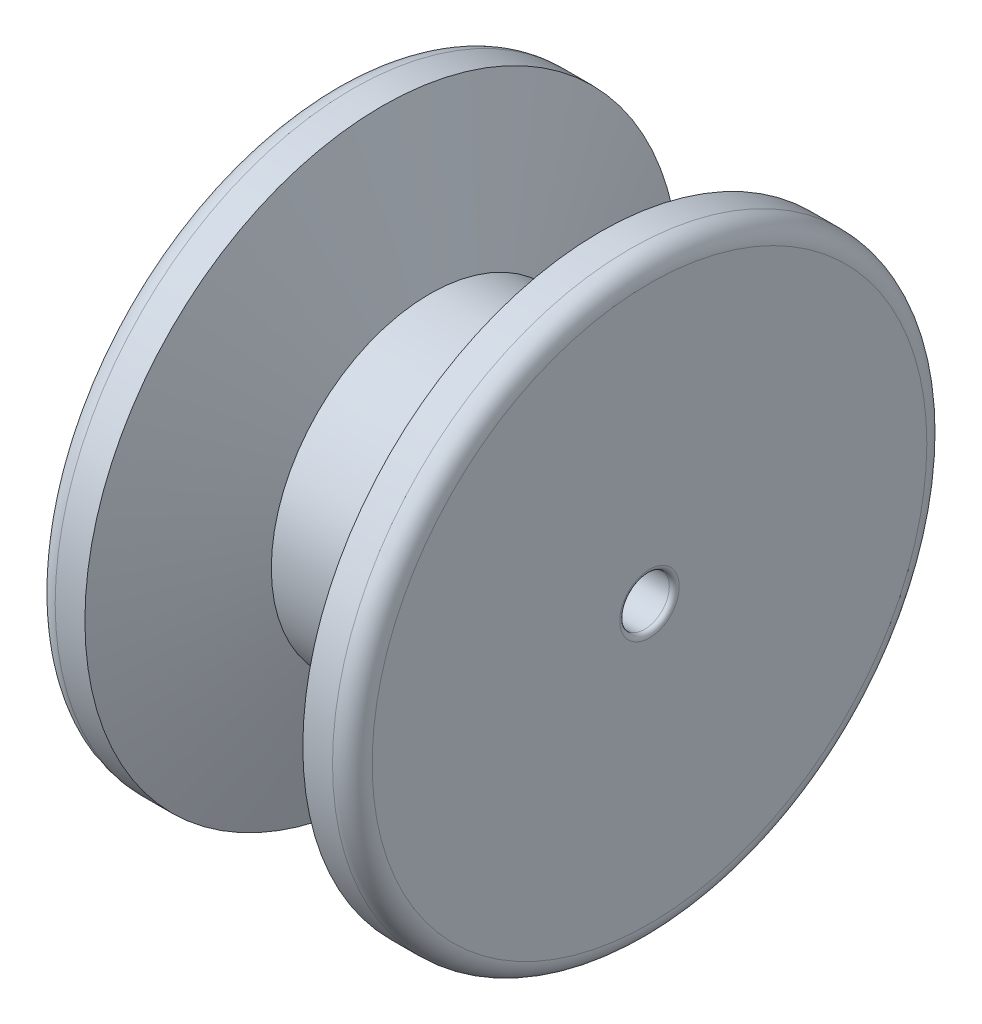
from build123d import *

# Parameters (mm, degrees)
REDONDEO2_R = 2
REDONDEO3_R = 0.5


with BuildPart() as part:
    # Croquis1 → Revolución1 (revolve)
    with BuildSketch(Plane.XY, mode=Mode.PRIVATE) as revoluci_n1_sk:
        Polygon((-16, 2.5), (-16, 30), (-11, 30), (-6.179413414, 16), (0, 16), (0, 2.5), align=None)
    revolve(revoluci_n1_sk.sketch.rotate(Axis((-29.031578947, 0, 0), (1, 0, 0)), 90), axis=Axis((-29.031578947, 0, 0), (1, 0, 0)))

    # Redondeo2
    redondeo2_edges = [part.edges().sort_by_distance(p)[0] for p in [
        (-16, 0, -30),
    ]]
    fillet(redondeo2_edges, radius=REDONDEO2_R)

    # Redondeo3
    redondeo3_edges = [part.edges().sort_by_distance(p)[0] for p in [
        (-16, 0, -2.5),
    ]]
    fillet(redondeo3_edges, radius=REDONDEO3_R)

    # Simetría2: part across plane


with BuildPart() as part_1:
    add(part.part)
    add(part.part.mirror(Plane(origin=(0, 0, 0), x_dir=(0, 0, 1), z_dir=(1, 0, 0))))


solid = part_1.part
